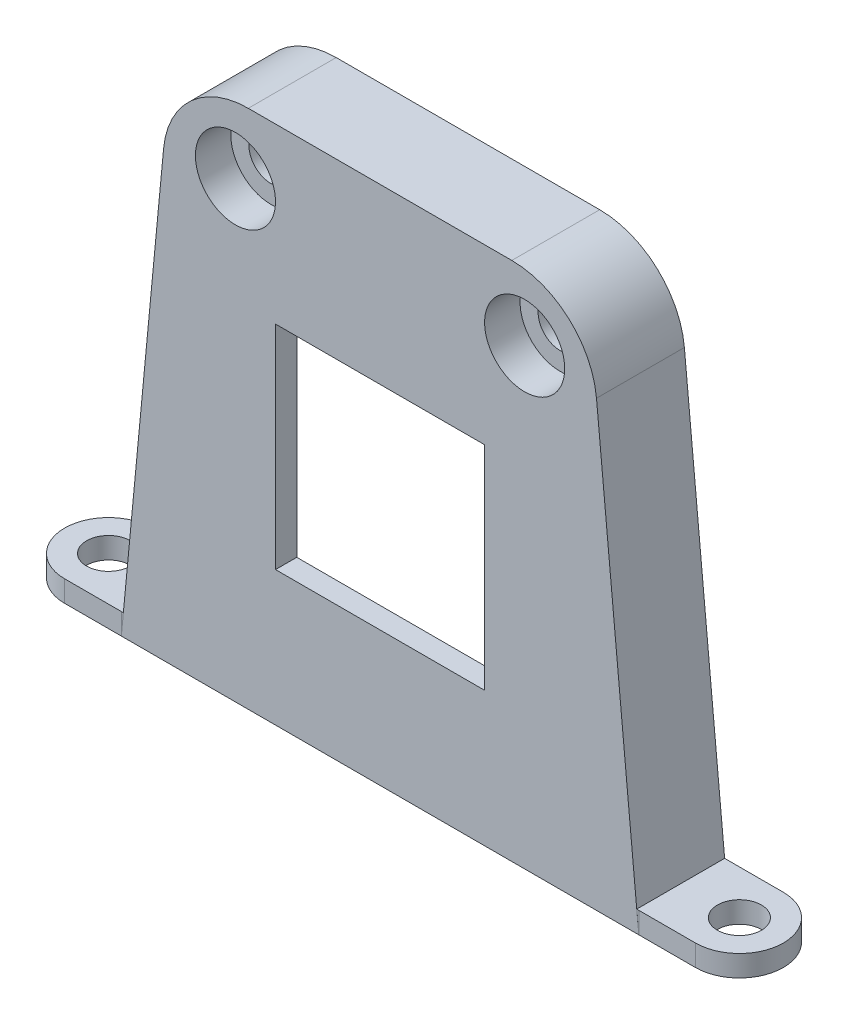
from build123d import *

# Parameters (mm, degrees)
BOSS_EXTRUDE1_DEPTH = 4.7
SKETCH2_W           = 24.5
SKETCH2_H           = 34.22
SKETCH2_W_2         = 14.75
SKETCH2_H_2         = 15
BOSS_EXTRUDE2_DEPTH = 1.5
SKETCH4_R           = 1.55
BOSS_EXTRUDE3_DEPTH = 3.5
SKETCH5_R           = 1.55
CUT_EXTRUDE1_DEPTH  = 28.197510916
SKETCH6_R           = 2.825
CUT_EXTRUDE2_DEPTH  = 2.5
SKETCH7_R           = 1.55
BOSS_EXTRUDE4_DEPTH = 1.5


with BuildPart() as part:
    # Sketch1 → Boss-Extrude1 (new body)
    with BuildSketch(Plane.XY):
        with BuildLine():
            Line((18.25, -17.11), (15.267630639, 14.179315124))
            ThreePointArc((15.267630639, 14.179315124), (13.331043423, 18.049363172), (9.294701685, 19.61))
            Line((9.294701685, 19.61), (-9.294701685, 19.61))
            ThreePointArc((-9.294701685, 19.61), (-13.331043423, 18.049363172), (-15.267630639, 14.179315124))
            Line((-15.267630639, 14.179315124), (-18.25, -17.11))
            Line((-18.25, -17.11), (-12.25, -17.11))
            Line((-12.25, -17.11), (-12.25, 17.11))
            Line((-12.25, 17.11), (12.25, 17.11))
            Line((12.25, 17.11), (12.25, -17.11))
            Line((12.25, -17.11), (18.25, -17.11))
        make_face()
    extrude(amount=BOSS_EXTRUDE1_DEPTH)

    # Sketch2 → Boss-Extrude2 (add)
    # profile 1 of 2: a face of its own
    with BuildSketch(Plane.XY.offset(4.7)):
        Rectangle(SKETCH2_W, SKETCH2_H)
        with Locations((0, -0.11)):
            Rectangle(SKETCH2_W_2, SKETCH2_H_2, mode=Mode.SUBTRACT)
    # profile 2 of 2: a face of its own
    with BuildSketch(Plane.XY.offset(4.7)):
        with BuildLine():
            Line((12.25, 17.11), (12.25, -17.11))
            Line((12.25, -17.11), (18.25, -17.11))
            Line((18.25, -17.11), (15.267630639, 14.179315124))
            ThreePointArc((15.267630639, 14.179315124), (13.331043423, 18.049363172), (9.294701685, 19.61))
            Line((9.294701685, 19.61), (-9.294701685, 19.61))
            ThreePointArc((-9.294701685, 19.61), (-13.331043423, 18.049363172), (-15.267630639, 14.179315124))
            Line((-15.267630639, 14.179315124), (-18.25, -17.11))
            Line((-18.25, -17.11), (-12.25, -17.11))
            Line((-12.25, -17.11), (-12.25, 17.11))
            Line((-12.25, 17.11), (12.25, 17.11))
        make_face()
    extrude(amount=BOSS_EXTRUDE2_DEPTH)

    # Sketch4 → Boss-Extrude3 (add)
    with BuildSketch(Plane(origin=(0, 0, 4.7), x_dir=(-1, 0, 0), z_dir=(0, 0, -1))):
        with BuildLine():
            Line((-12.25, 17.11), (-7.25, 17.11))
            Line((-7.25, 17.11), (-7.25, 13.51))
            ThreePointArc((-7.25, 13.51), (-7.689339828, 12.449339828), (-8.75, 12.01))
            Line((-8.75, 12.01), (-12.25, 12.01))
            Line((-12.25, 12.01), (-12.25, 17.11))
        make_face()
        with Locations((-10.2, 14.86)):
            Circle(SKETCH4_R, mode=Mode.SUBTRACT)
    boss_extrude3 = extrude(amount=BOSS_EXTRUDE3_DEPTH)

    # Sketch5 → Cut-Extrude1 (cut, through all)
    with BuildSketch(Plane(origin=(0, 0, 4.7), x_dir=(-1, 0, 0), z_dir=(0, 0, -1))):
        with Locations((-10.2, 14.86)):
            Circle(SKETCH5_R)
    extrude(amount=-CUT_EXTRUDE1_DEPTH, mode=Mode.SUBTRACT)

    # Sketch6 → Cut-Extrude2 (cut)
    with BuildSketch(Plane.XY.offset(6.2)):
        with Locations((10.2, 14.86)):
            Circle(SKETCH6_R)
    cut_extrude2 = extrude(amount=-CUT_EXTRUDE2_DEPTH, mode=Mode.SUBTRACT)

    # Sketch7 → Boss-Extrude4 (add)
    with BuildSketch(Plane.XZ.offset(17.11)):
        with BuildLine():
            Line((-22.25, 6.2), (-18.25, 6.2))
            ThreePointArc((-18.25, 6.2), (-15.15, 3.1), (-18.25, 0))
            Line((-18.25, 0), (-22.25, 0))
            ThreePointArc((-22.25, 0), (-25.35, 3.1), (-22.25, 6.2))
        make_face()
        with Locations(Location((-22.25, 3.1, 0), (0, 0, 270))):
            Circle(SKETCH7_R, mode=Mode.SUBTRACT)
    boss_extrude4 = extrude(amount=-BOSS_EXTRUDE4_DEPTH)

    # Mirror1: Boss-Extrude3, Cut-Extrude2, Boss-Extrude4 across plane
    add(boss_extrude3.mirror(Plane(origin=(0, 0, 0), x_dir=(0, 0, 1), z_dir=(1, 0, 0))))
    add(cut_extrude2.mirror(Plane(origin=(0, 0, 0), x_dir=(0, 0, 1), z_dir=(1, 0, 0))), mode=Mode.SUBTRACT)
    add(boss_extrude4.mirror(Plane(origin=(0, 0, 0), x_dir=(0, 0, 1), z_dir=(1, 0, 0))))


solid = part.part
